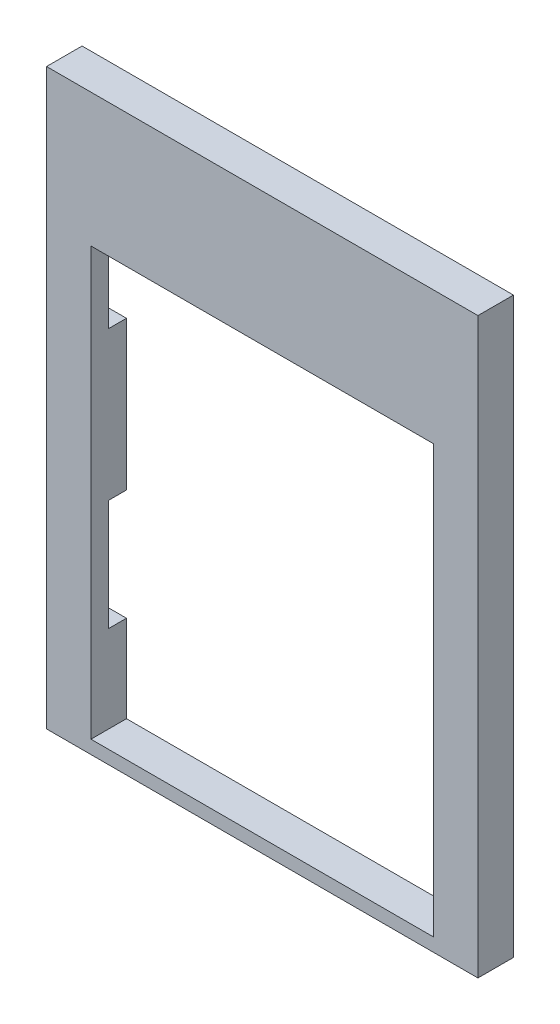
from build123d import *

# Parameters (mm, degrees)
MODEL_W             = 77.14935
MODEL_H             = 96.19946
EXTRUDE_1_DEPTH     = 4
SKETCH_4_W          = 8
SKETCH_4_H          = 25
CUT_EXTRUDE_1_DEPTH = 227.33223095


with BuildPart() as part:
    # Model → 凸台-拉伸1 (new, symmetric)
    with BuildSketch(Plane.XY):
        Polygon((189.309527429, 123.984602236), (92.160177429, 123.984602236), (92.160177429, -5.214857764), (102.160177429, -5.214857764), (189.309527429, -5.214857764), align=None)
        with Locations((140.734852429, 45.884872236)):
            Rectangle(MODEL_W, MODEL_H, mode=Mode.SUBTRACT)
    extrude(amount=EXTRUDE_1_DEPTH, both=True)

    # 草图4 → 切除-拉伸1 (cut, through all)
    with BuildSketch(Plane.XY):
        with Locations((98.160177429, 29.884872236)):
            Rectangle(SKETCH_4_W, SKETCH_4_H)
        with Locations((183.309527429, 88.384872236)):
            Rectangle(SKETCH_4_W, SKETCH_4_H)
        with Locations((98.160177429, 88.384872236)):
            Rectangle(SKETCH_4_W, SKETCH_4_H)
        with Locations((183.309527429, 29.884872236)):
            Rectangle(SKETCH_4_W, SKETCH_4_H)
    extrude(amount=-CUT_EXTRUDE_1_DEPTH, mode=Mode.SUBTRACT)


solid = part.part
